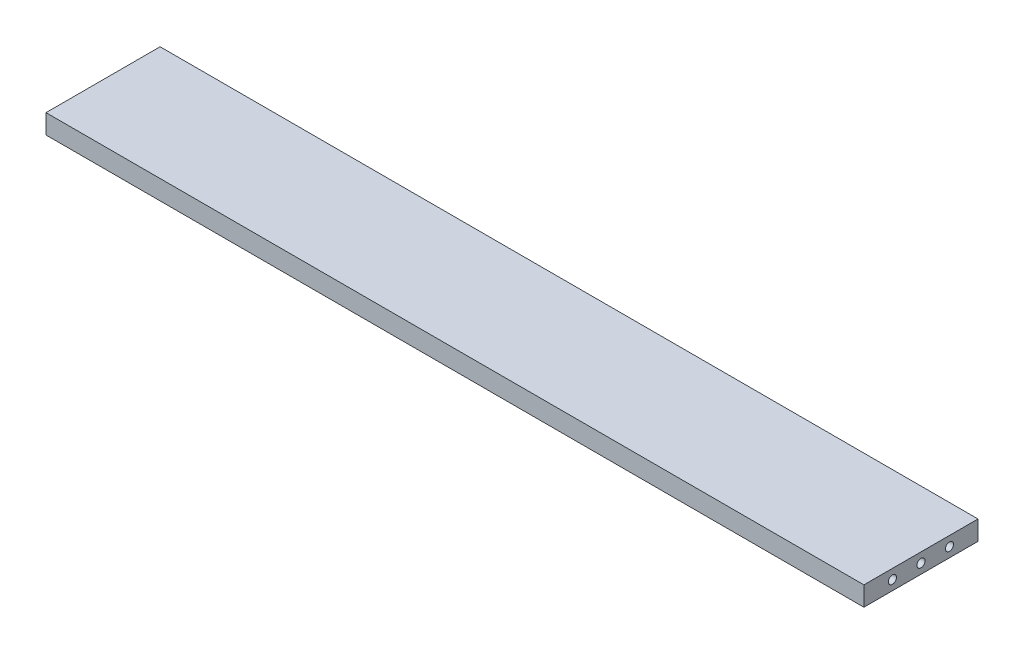
from build123d import *

# Parameters (mm, degrees)
ESBO_O1_W                = 401.43
ESBO_O1_H                = 56
RESSALTO_EXTRUS_O1_DEPTH = 9.525
ESBO_O2_R                = 2
CORTE_EXTRUS_O1_DEPTH    = 30
CORTE_EXTRUS_O2_START    = -20
ESBO_O3_R                = 2
CORTE_EXTRUS_O2_DEPTH    = 20


with BuildPart() as part:
    # Esboço1 → Ressalto-extrusão1 (new body)
    with BuildSketch(Plane(origin=(0, 0, 0), x_dir=(1, 0, 0), z_dir=(0, 1, 0))):
        Rectangle(ESBO_O1_W, ESBO_O1_H)
    extrude(amount=RESSALTO_EXTRUS_O1_DEPTH)

    # Esboço2 → Corte-extrusão1 (cut)
    with BuildSketch(Plane(origin=(200.715, 0, 0), x_dir=(0, 0, -1), z_dir=(1, 0, 0))):
        with Locations((-14, 4.7625)):
            Circle(ESBO_O2_R)
        with Locations((0, 4.7625)):
            Circle(ESBO_O2_R)
        with Locations((14, 4.7625)):
            Circle(ESBO_O2_R)
    extrude(amount=-CORTE_EXTRUS_O1_DEPTH, mode=Mode.SUBTRACT)

    # Esboço3 → Corte-extrusão2 (cut)
    with BuildSketch(Plane.ZY.offset(200.715).offset(CORTE_EXTRUS_O2_START)):
        with Locations(Location((-14, 4.7625, 0), (0, 0, 180))):
            Circle(ESBO_O3_R)
        with Locations(Location((0, 4.7625, 0), (0, 0, 180))):
            Circle(ESBO_O3_R)
        with Locations(Location((14, 4.7625, 0), (0, 0, 180))):
            Circle(ESBO_O3_R)
    extrude(amount=CORTE_EXTRUS_O2_DEPTH, mode=Mode.SUBTRACT)


solid = part.part
